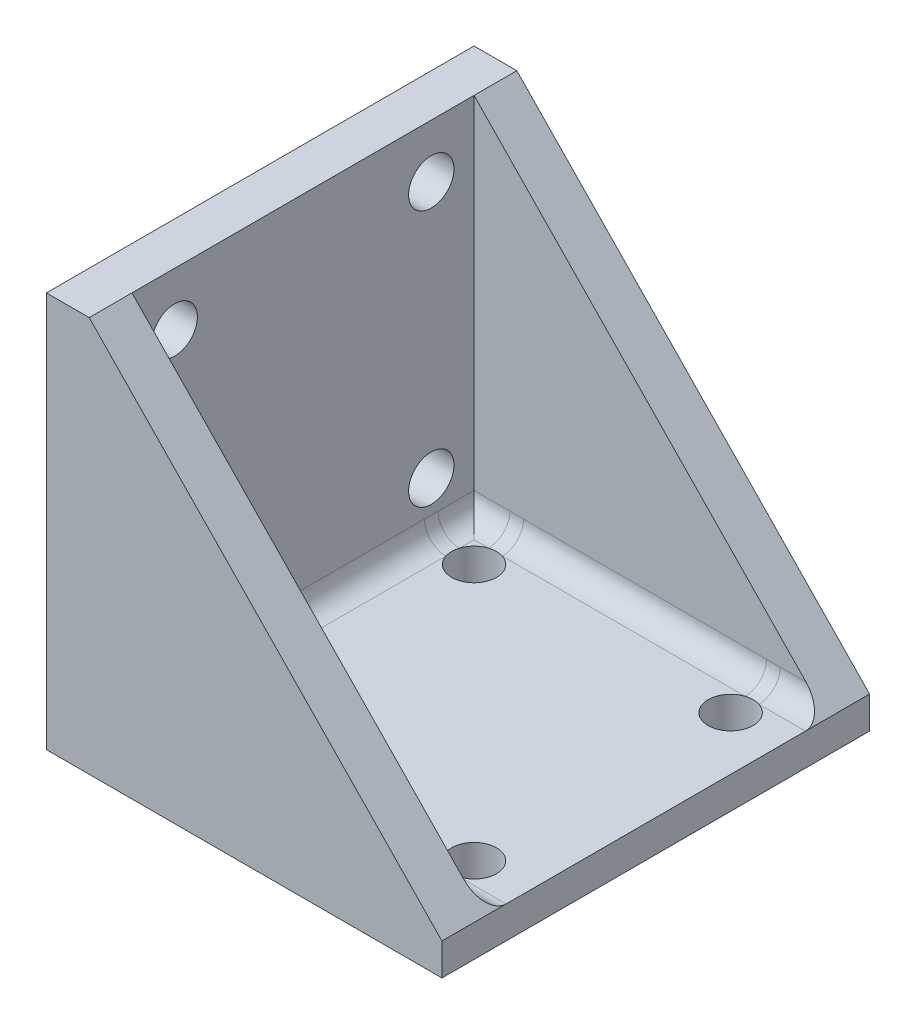
from build123d import *

# Parameters (mm, degrees)
SSS_W               = 37
SSS_H               = 40
SSS_R               = 2.1
BOSS_EXTRUDE2_DEPTH = 3
SKETCH1_W           = 40
SKETCH1_H           = 37
SKETCH1_R           = 2.125
BOSS_EXTRUDE3_DEPTH = 4
BOSS_EXTRUDE4_DEPTH = 4
FILLET1_R           = 2


with BuildPart() as part:
    # sss → Boss-Extrude2 (new body)
    with BuildSketch(Plane(origin=(0, 0, 0), x_dir=(1, 0, 0), z_dir=(0, 1, 0))):
        with Locations((-1.5, 0)):
            Rectangle(SSS_W, SSS_H)
        with Locations(Location((-12, 12, 0), (0, 0, 270))):
            Circle(SSS_R, mode=Mode.SUBTRACT)
        with Locations(Location((12, 12, 0), (0, 0, 90))):
            Circle(SSS_R, mode=Mode.SUBTRACT)
        with Locations(Location((12, -12, 0), (0, 0, 270))):
            Circle(SSS_R, mode=Mode.SUBTRACT)
        with Locations(Location((-12, -12, 0), (0, 0, 90))):
            Circle(SSS_R, mode=Mode.SUBTRACT)
    extrude(amount=BOSS_EXTRUDE2_DEPTH)

    # Sketch1 → Boss-Extrude3 (add)
    with BuildSketch(Plane.ZY.offset(20)):
        with Locations((0, 18.5)):
            Rectangle(SKETCH1_W, SKETCH1_H)
        with Locations((-12, 32)):
            Circle(SKETCH1_R, mode=Mode.SUBTRACT)
        with Locations(Location((12, 32, 0), (0, 0, 180))):
            Circle(SKETCH1_R, mode=Mode.SUBTRACT)
        with Locations((12, 8)):
            Circle(SKETCH1_R, mode=Mode.SUBTRACT)
        with Locations(Location((-12, 8, 0), (0, 0, 180))):
            Circle(SKETCH1_R, mode=Mode.SUBTRACT)
    extrude(amount=-BOSS_EXTRUDE3_DEPTH)

    # Sketch2 → Boss-Extrude4 (add)
    with BuildSketch(Plane.XY.offset(20)):
        Polygon((-20, 37), (-20, 0), (17, 0), (17, 3), (-16, 37), align=None)
    boss_extrude4 = extrude(amount=-BOSS_EXTRUDE4_DEPTH)

    # Mirror1: Boss-Extrude4 across plane
    add(boss_extrude4.mirror(Plane.XY))

    # Fillet1
    fillet1_edges = [part.edges().sort_by_distance(p)[0] for p in [
        (0.5, 3, 16),
        (-16, 3, 0),
        (0.5, 3, -16),
    ]]
    fillet(fillet1_edges, radius=FILLET1_R)


solid = part.part
